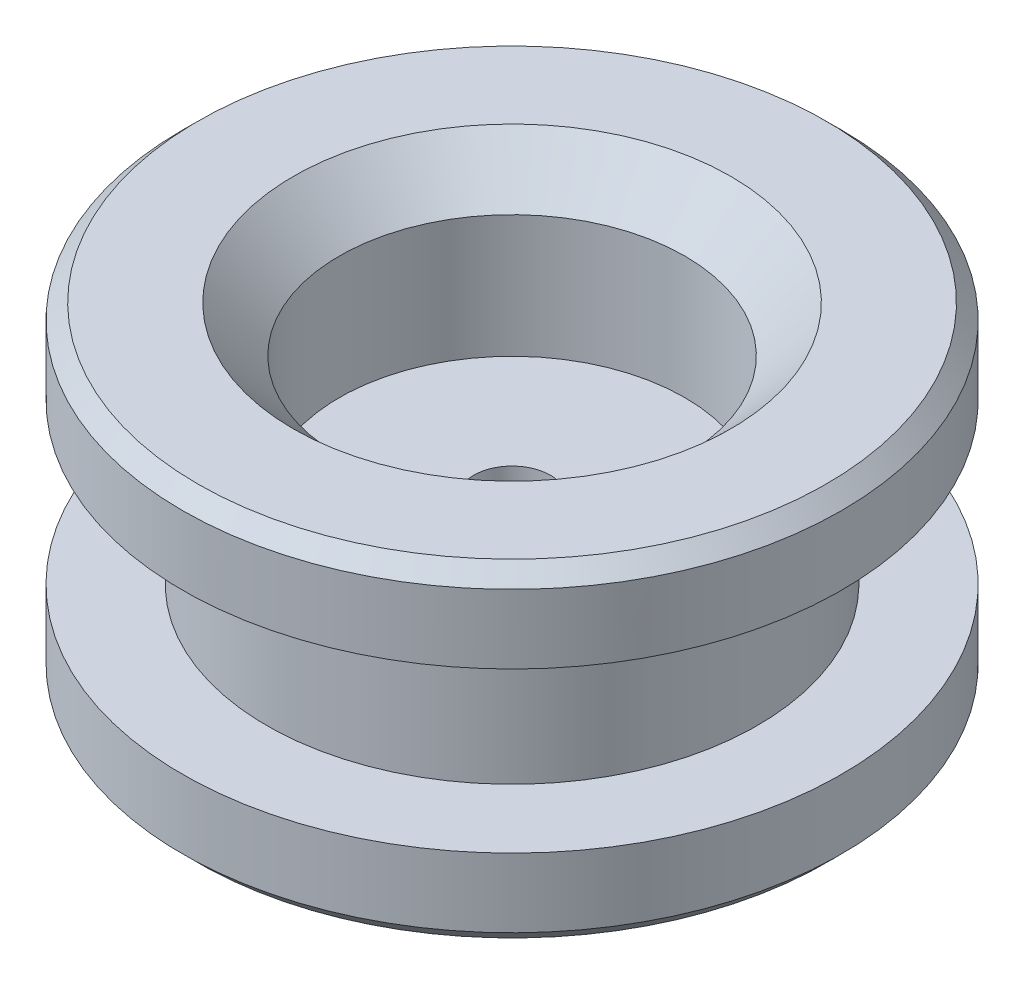
from build123d import *

# Parameters (mm, degrees)
CHAMFER1_SIZE = 3
CHAMFER2_SIZE = 1


with BuildPart() as part:
    # Sketch1 → Revolve1 (revolve)
    with BuildSketch(Plane.XY, mode=Mode.PRIVATE) as revolve1_sk:
        Polygon((2.5, 40.545486338), (11.269263071, 40.545486338), (11.269263071, 51.545486338), (21.5, 51.545486338), (21.5, 46.045486338), (16, 46.045486338), (16, 35.645486338), (21.5, 35.645486338), (21.5, 30.145486338), (2.5, 30.145486338), align=None)
    revolve(revolve1_sk.sketch.rotate(Axis((0, 0, 0), (0, 1, 0)), 90), axis=Axis((0, 0, 0), (0, 1, 0)))

    # Chamfer1
    chamfer1_edges = [part.edges().sort_by_distance(p)[0] for p in [
        (0, 51.545486338, 11.269263071),
    ]]
    chamfer(chamfer1_edges, length=CHAMFER1_SIZE)

    # Chamfer2
    chamfer2_edges = [part.edges().sort_by_distance(p)[0] for p in [
        (0, 30.145486338, 21.5),
        (0, 51.545486338, 21.5),
    ]]
    chamfer(chamfer2_edges, length=CHAMFER2_SIZE)


solid = part.part
